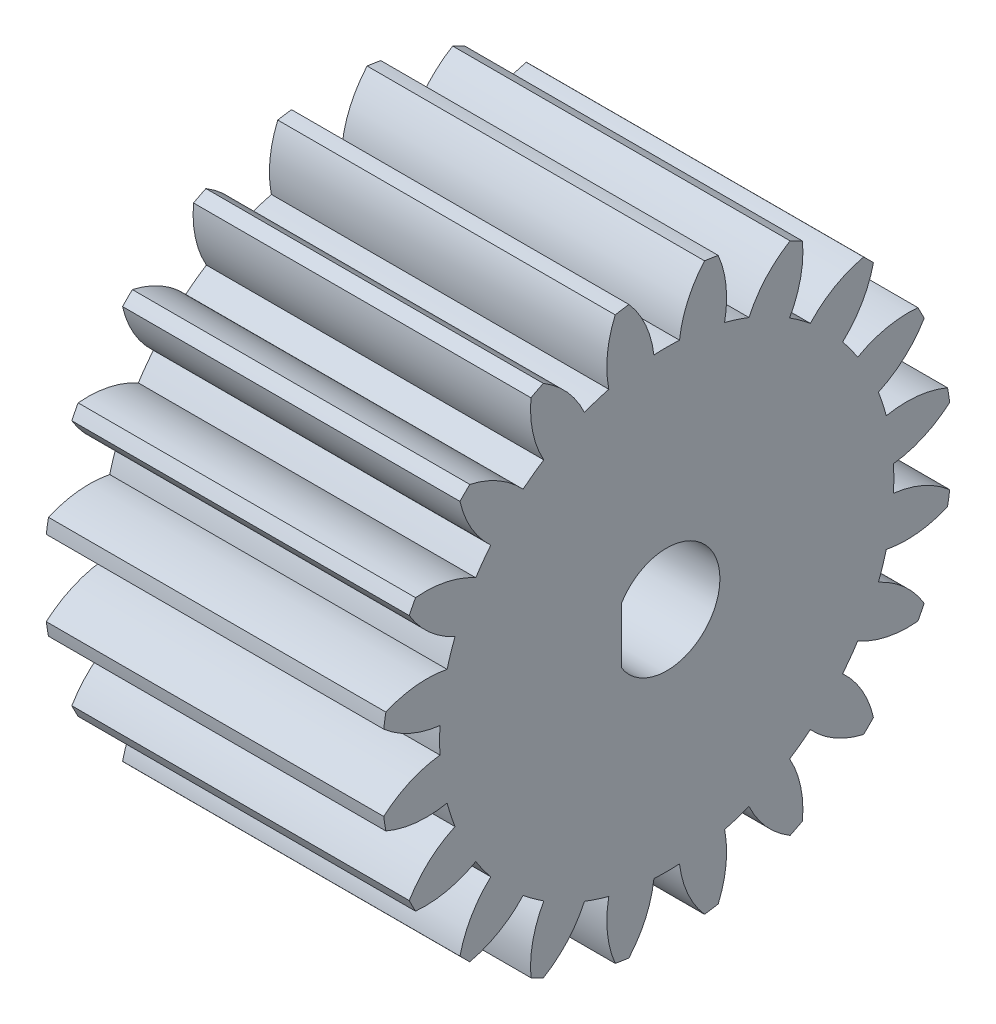
from build123d import *

# Parameters (mm, degrees)
BASPROSKE_W     = 26
BASPROSKE_H     = 22
TOOTHCUT_DEPTH  = 41.546269865
TEETHCUTS_COUNT = 20
TEETHCUTS_ANGLE = 342
BORE_DEPTH      = 50.0000508


with BuildPart() as part:
    # BasProSke → Base-Revolve (revolve)
    with BuildSketch(Plane(origin=(0, 0, 0), x_dir=(1, 0, 0), z_dir=(0, 1, 0)), mode=Mode.PRIVATE) as base_revolve_sk:
        with Locations((13, 11)):
            Rectangle(BASPROSKE_W, BASPROSKE_H)
    revolve(base_revolve_sk.sketch.rotate(Axis((-10, 0, 0), (1, 0, 0)), 180), axis=Axis((-10, 0, 0), (1, 0, 0)))

    # TooCutSke → ToothCut (cut, through all)
    with BuildSketch(Plane(origin=(0, 0, 0), x_dir=(0, 0, -1), z_dir=(1, 0, 0))):
        with BuildLine():
            ThreePointArc((0.986171591, 17.471189616), (0, 17.499), (-0.986171591, 17.471189616))
            ThreePointArc((-0.986171591, 17.471189616), (-1.626916196, 19.798789858), (-2.932850173, 21.829260982))
            ThreePointArc((-2.932850173, 21.829260982), (0, 22.0254), (2.932850173, 21.829260982))
            ThreePointArc((2.932850173, 21.829260982), (1.626916196, 19.798789858), (0.986171591, 17.471189616))
        make_face()
    toothcut = extrude(amount=TOOTHCUT_DEPTH, mode=Mode.SUBTRACT)

    # TeethCuts: ToothCut ×20 about axis
    teethcuts_axis = Axis((-10, 0, 0), (1, 0, 0))
    for i in range(1, TEETHCUTS_COUNT):
        add(toothcut.rotate(teethcuts_axis, i * TEETHCUTS_ANGLE / (TEETHCUTS_COUNT - 1)), mode=Mode.SUBTRACT)

    # BorSke → Bore (cut, symmetric)
    with BuildSketch(Plane(origin=(0, 0, 0), x_dir=(0, 0, -1), z_dir=(1, 0, 0))):
        with BuildLine():
            Line((-3.5, 2.13541565), (-3.5, -2.13541565))
            ThreePointArc((-3.5, -2.13541565), (4.1, 0), (-3.5, 2.13541565))
        make_face()
    extrude(amount=BORE_DEPTH, both=True, mode=Mode.SUBTRACT)


solid = part.part
